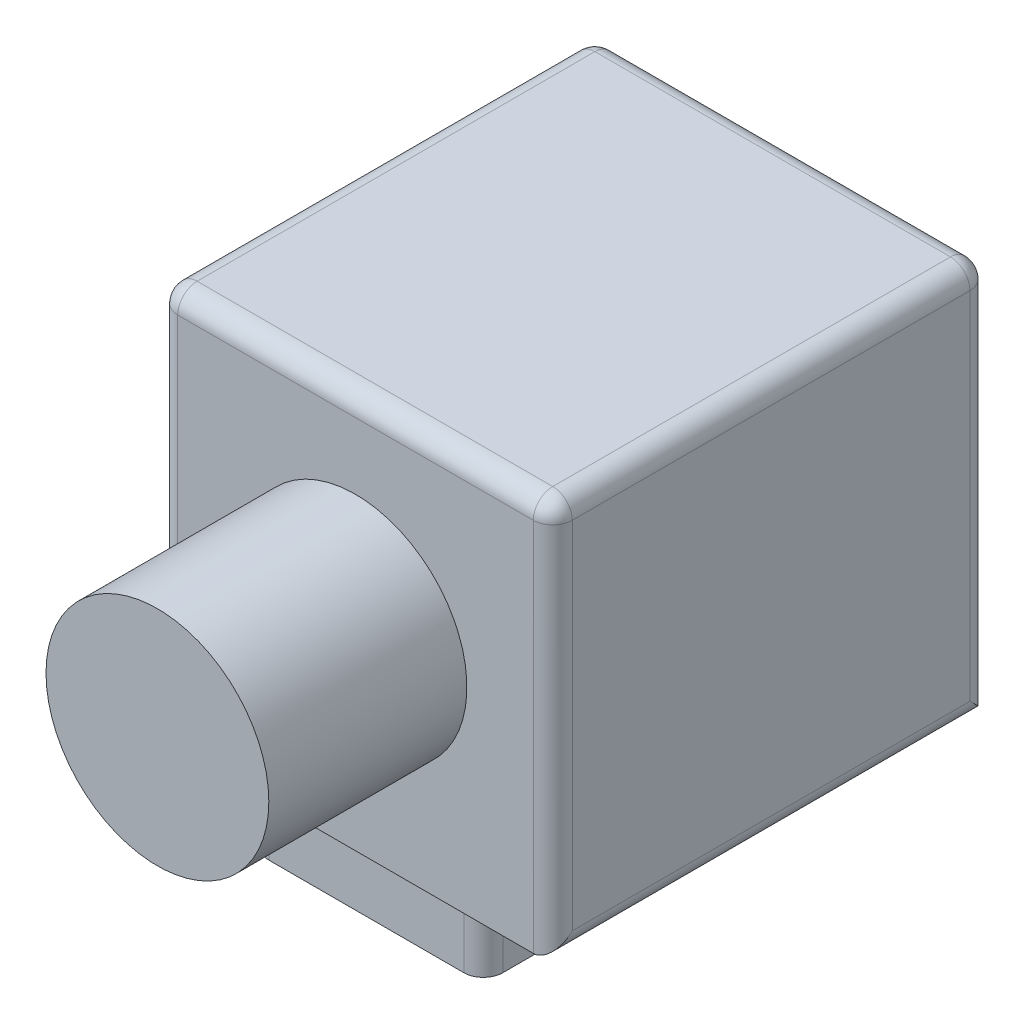
from build123d import *

# Parameters (mm, degrees)
SKETCH2_W                       = 50.6
SKETCH2_H                       = 56
BOSS_EXTRUDE1_DEPTH             = 50.6
SKETCH3_W                       = 30
SKETCH3_H                       = 53.2
BOSS_EXTRUDE2_DEPTH             = 8
TAP_DRILL_FOR_M6X1_0_TAP1_D     = 5
TAP_DRILL_FOR_M6X1_0_TAP1_DEPTH = 7.5000104
TAP_DRILL_FOR_M6X1_0_TAP1_TIP   = 1.502151548
TAP_DRILL_FOR_1_4_20_TAP1_D     = 5.1054
TAP_DRILL_FOR_1_4_20_TAP1_DEPTH = 7.62
TAP_DRILL_FOR_1_4_20_TAP1_TIP   = 1.533816902
SKETCH11_R                      = 14.2875
BOSS_EXTRUDE3_DEPTH             = 25.4
FILLET1_R                       = 2.5


with BuildPart() as part:
    # Sketch2 → Boss-Extrude1 (new body)
    with BuildSketch(Plane(origin=(0, 0, 0), x_dir=(1, 0, 0), z_dir=(0, 1, 0))):
        with Locations((25.3, 28)):
            Rectangle(SKETCH2_W, SKETCH2_H)
    extrude(amount=BOSS_EXTRUDE1_DEPTH)

    # Sketch3 → Boss-Extrude2 (add)
    with BuildSketch(Plane.XZ):
        with Locations((25.3, -28)):
            Rectangle(SKETCH3_W, SKETCH3_H)
    extrude(amount=BOSS_EXTRUDE2_DEPTH)

    # Tap Drill for M6x1.0 Tap1
    with Locations(Plane.XZ.offset(8)):
        with Locations((25.3, -35.25), (25.3, -48.5), (25.3, -6.3)):
            Hole(TAP_DRILL_FOR_M6X1_0_TAP1_D / 2, depth=TAP_DRILL_FOR_M6X1_0_TAP1_DEPTH)
            with Locations((0, 0, -(TAP_DRILL_FOR_M6X1_0_TAP1_DEPTH + TAP_DRILL_FOR_M6X1_0_TAP1_TIP / 2))):  # 118° drill point
                Cone(0, TAP_DRILL_FOR_M6X1_0_TAP1_D / 2, TAP_DRILL_FOR_M6X1_0_TAP1_TIP, mode=Mode.SUBTRACT)

    # Tap Drill for 1/4-20 Tap1
    with Locations(Plane.XZ.offset(8)):
        with Locations((25.3, -22)):
            Hole(TAP_DRILL_FOR_1_4_20_TAP1_D / 2, depth=TAP_DRILL_FOR_1_4_20_TAP1_DEPTH)
            with Locations((0, 0, -(TAP_DRILL_FOR_1_4_20_TAP1_DEPTH + TAP_DRILL_FOR_1_4_20_TAP1_TIP / 2))):  # 118° drill point
                Cone(0, TAP_DRILL_FOR_1_4_20_TAP1_D / 2, TAP_DRILL_FOR_1_4_20_TAP1_TIP, mode=Mode.SUBTRACT)

    # Sketch11 → Boss-Extrude3 (add)
    with BuildSketch(Plane.XY):
        with Locations(Location((25.3, 25.3, 0), (0, 0, 180))):
            Circle(SKETCH11_R)
    extrude(amount=BOSS_EXTRUDE3_DEPTH)

    # Fillet1
    fillet1_edges = [part.edges().sort_by_distance(p)[0] for p in [
        (50.6, 50.6, -28),
        (25.3, 50.6, -56),
        (10.3, -4, -1.4),
        (10.3, -4, -54.6),
        (40.3, -4, -54.6),
        (40.3, -4, -1.4),
        (0, 50.6, -28),
        (50.6, 0, -28),
        (0, 0, -28),
        (25.3, 50.6, 0),
        (0, 25.3, -56),
        (50.6, 25.3, -56),
        (50.6, 25.3, 0),
        (0, 25.3, 0),
    ]]
    fillet(fillet1_edges, radius=FILLET1_R)


solid = part.part
